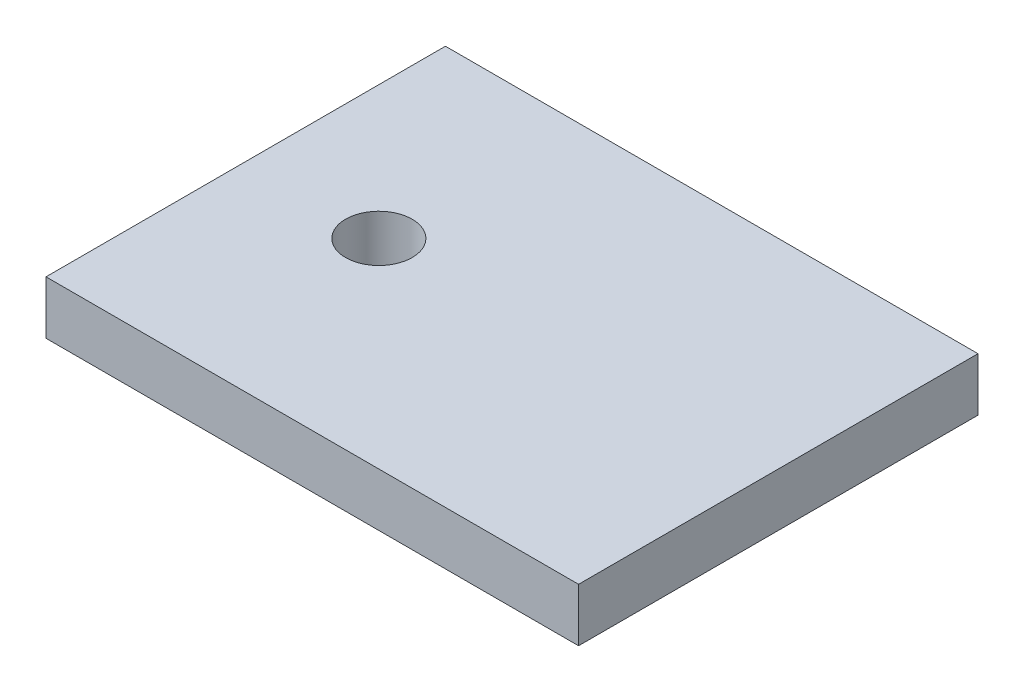
from build123d import *

# Parameters (mm, degrees)
SKETCH1_W           = 40
SKETCH1_H           = 30
BOSS_EXTRUDE1_DEPTH = 4
SKETCH2_R           = 2.5
CUT_EXTRUDE1_DEPTH  = 4


with BuildPart() as part:
    # Sketch1 → Boss-Extrude1 (new body)
    with BuildSketch(Plane(origin=(0, 0, 0), x_dir=(1, 0, 0), z_dir=(0, 1, 0))):
        Rectangle(SKETCH1_W, SKETCH1_H)
    extrude(amount=BOSS_EXTRUDE1_DEPTH)

    # Sketch2 → Cut-Extrude1 (cut)
    with BuildSketch(Plane(origin=(0, 4, 0), x_dir=(1, 0, 0), z_dir=(0, 1, 0))):
        with Locations(Location((-10, 0, 0), (0, 0, 270))):
            Circle(SKETCH2_R)
    extrude(amount=-CUT_EXTRUDE1_DEPTH, mode=Mode.SUBTRACT)


solid = part.part
